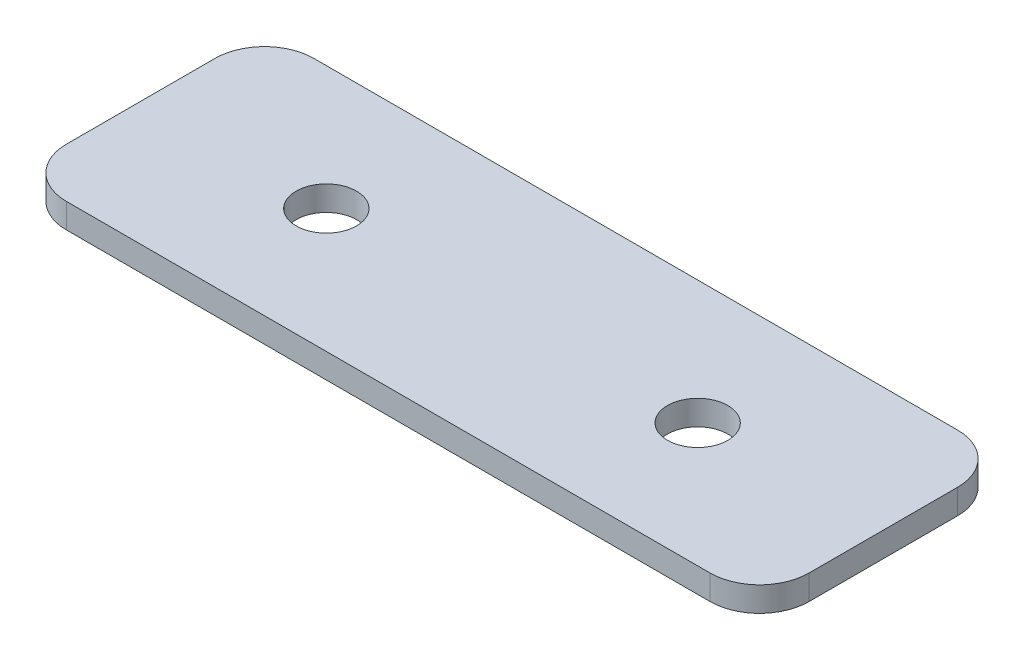
from build123d import *

# Parameters (mm, degrees)
SKETCH2_W           = 30
SKETCH2_H           = 10
SKETCH2_R           = 1.2192
BOSS_EXTRUDE1_DEPTH = 1
FILLET1_R           = 2


with BuildPart() as part:
    # Sketch2 → Boss-Extrude1 (new body)
    with BuildSketch(Plane(origin=(0, 0, 0), x_dir=(1, 0, 0), z_dir=(0, 1, 0))):
        Rectangle(SKETCH2_W, SKETCH2_H)
        with Locations(Location((7.5, 0, 0), (0, 0, 270))):
            Circle(SKETCH2_R, mode=Mode.SUBTRACT)
        with Locations(Location((-7.5, 0, 0), (0, 0, 270))):
            Circle(SKETCH2_R, mode=Mode.SUBTRACT)
    extrude(amount=BOSS_EXTRUDE1_DEPTH)

    # Fillet1
    fillet1_edges = [part.edges().sort_by_distance(p)[0] for p in [
        (-15, 0.5, -5),
        (15, 0.5, -5),
        (15, 0.5, 5),
        (-15, 0.5, 5),
    ]]
    fillet(fillet1_edges, radius=FILLET1_R)


solid = part.part
